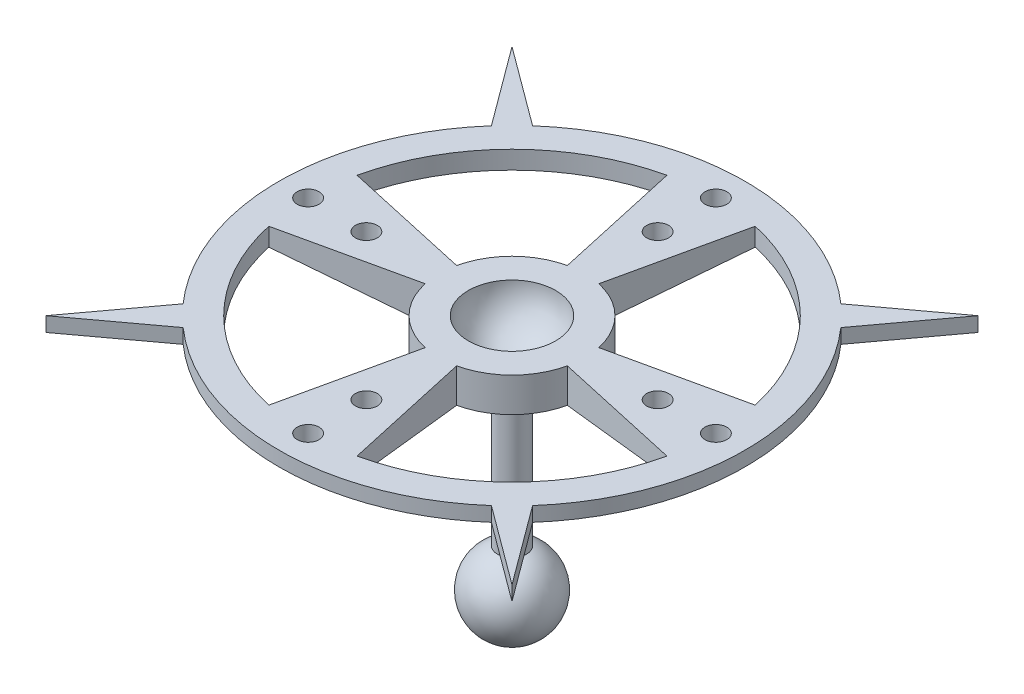
from build123d import *

# Parameters (mm, degrees)
SKETCH4_R           = 0.75
CUT_EXTRUDE2_DEPTH  = 4
BOSS_EXTRUDE2_DEPTH = 1


with BuildPart() as part:
    # Sketch1 → Revolve1 (revolve)
    with BuildSketch(Plane(origin=(0, 0, 0), x_dir=(0, 0, -1), z_dir=(1, 0, 0))):
        with BuildLine():
            ThreePointArc((-3, 4), (-2.121320344, 1.878679656), (0, 1))
            Line((0, 1), (0, 0))
            Line((0, 0), (0, -9.5))
            Line((0, -9.5), (0, -15.1))
            ThreePointArc((0, -15.1), (-2.753447859, -12.808453427), (-1, -9.684660634))
            Line((-1, -9.684660634), (-1, 0.127016654))
            ThreePointArc((-1, 0.127016654), (-2.123180734, 0.609999474), (-3.048002331, 1.409694653))
            Line((-3.048002331, 1.409694653), (-16, 3))
            Line((-16, 3), (-16, 4))
            Line((-16, 4), (-4, 4))
            Line((-4, 4), (-3, 4))
        make_face()
    revolve(axis=Axis((0, 10.634252877, 0), (0, 1, 0)))

    # Sketch4 → Cut-Extrude2 (cut)
    with BuildSketch(Plane(origin=(0, 4, 0), x_dir=(1, 0, 0), z_dir=(0, 1, 0))):
        with BuildLine():
            Line((-1.08219807, 4.881480036), (-3.030154595, 13.6681441))
            ThreePointArc((-3.030154595, 13.6681441), (-9.899494937, 9.899494937), (-13.6681441, 3.030154595))
            Line((-13.6681441, 3.030154595), (-4.881480036, 1.08219807))
            ThreePointArc((-4.881480036, 1.08219807), (-3.535533906, 3.535533906), (-1.08219807, 4.881480036))
        make_face()
        with BuildLine():
            Line((-4.881480036, -1.08219807), (-13.6681441, -3.030154595))
            ThreePointArc((-13.6681441, -3.030154595), (-9.899494937, -9.899494937), (-3.030154595, -13.6681441))
            Line((-3.030154595, -13.6681441), (-1.08219807, -4.881480036))
            ThreePointArc((-1.08219807, -4.881480036), (-3.535533906, -3.535533906), (-4.881480036, -1.08219807))
        make_face()
        with BuildLine():
            ThreePointArc((3.030154595, -13.6681441), (9.899494937, -9.899494937), (13.6681441, -3.030154595))
            Line((13.6681441, -3.030154595), (4.881480036, -1.08219807))
            ThreePointArc((4.881480036, -1.08219807), (3.535533906, -3.535533906), (1.08219807, -4.881480036))
            Line((1.08219807, -4.881480036), (3.030154595, -13.6681441))
        make_face()
        with BuildLine():
            ThreePointArc((13.6681441, 3.030154595), (9.899494937, 9.899494937), (3.030154595, 13.6681441))
            Line((3.030154595, 13.6681441), (1.08219807, 4.881480036))
            ThreePointArc((1.08219807, 4.881480036), (3.535533906, 3.535533906), (4.881480036, 1.08219807))
            Line((4.881480036, 1.08219807), (13.6681441, 3.030154595))
        make_face()
        with Locations(Location((-14, 0, 0), (0, 0, 134.876670286))):
            Circle(SKETCH4_R)
        with Locations(Location((-10, 0, 0), (0, 0, 43.63623207))):
            Circle(SKETCH4_R)
        with Locations(Location((0, 10, 0), (0, 0, 270))):
            Circle(SKETCH4_R)
        with Locations(Location((0, 14, 0), (0, 0, 270))):
            Circle(SKETCH4_R)
        with Locations(Location((0, -10, 0), (0, 0, 90))):
            Circle(SKETCH4_R)
        with Locations(Location((0, -14, 0), (0, 0, 270.000000015))):
            Circle(SKETCH4_R)
        with Locations(Location((10, 0, 0), (0, 0, 270))):
            Circle(SKETCH4_R)
        with Locations(Location((14, 0, 0), (0, 0, 270))):
            Circle(SKETCH4_R)
    extrude(amount=-CUT_EXTRUDE2_DEPTH, mode=Mode.SUBTRACT)

    # Sketch5 → Boss-Extrude2 (add)
    with BuildSketch(Plane(origin=(0, 4, 0), x_dir=(1, 0, 0), z_dir=(0, 1, 0))):
        with BuildLine():
            ThreePointArc((-11.998696572, 10.584483009), (-11.313708499, 11.313708499), (-10.584483009, 11.998696572))
            Line((-10.584483009, 11.998696572), (-16, 16))
            Line((-16, 16), (-11.998696572, 10.584483009))
        make_face()
        with BuildLine():
            Line((16, 16), (10.584483009, 11.998696572))
            ThreePointArc((10.584483009, 11.998696572), (11.313708499, 11.313708499), (11.998696572, 10.584483009))
            Line((11.998696572, 10.584483009), (16, 16))
        make_face()
        with BuildLine():
            ThreePointArc((11.998696572, -10.584483009), (11.313708499, -11.313708499), (10.584483009, -11.998696572))
            Line((10.584483009, -11.998696572), (16, -16))
            Line((16, -16), (11.998696572, -10.584483009))
        make_face()
        with BuildLine():
            ThreePointArc((-10.584483009, -11.998696572), (-11.313708499, -11.313708499), (-11.998696572, -10.584483009))
            Line((-11.998696572, -10.584483009), (-16, -16))
            Line((-16, -16), (-10.584483009, -11.998696572))
        make_face()
    extrude(amount=-BOSS_EXTRUDE2_DEPTH)


solid = part.part
